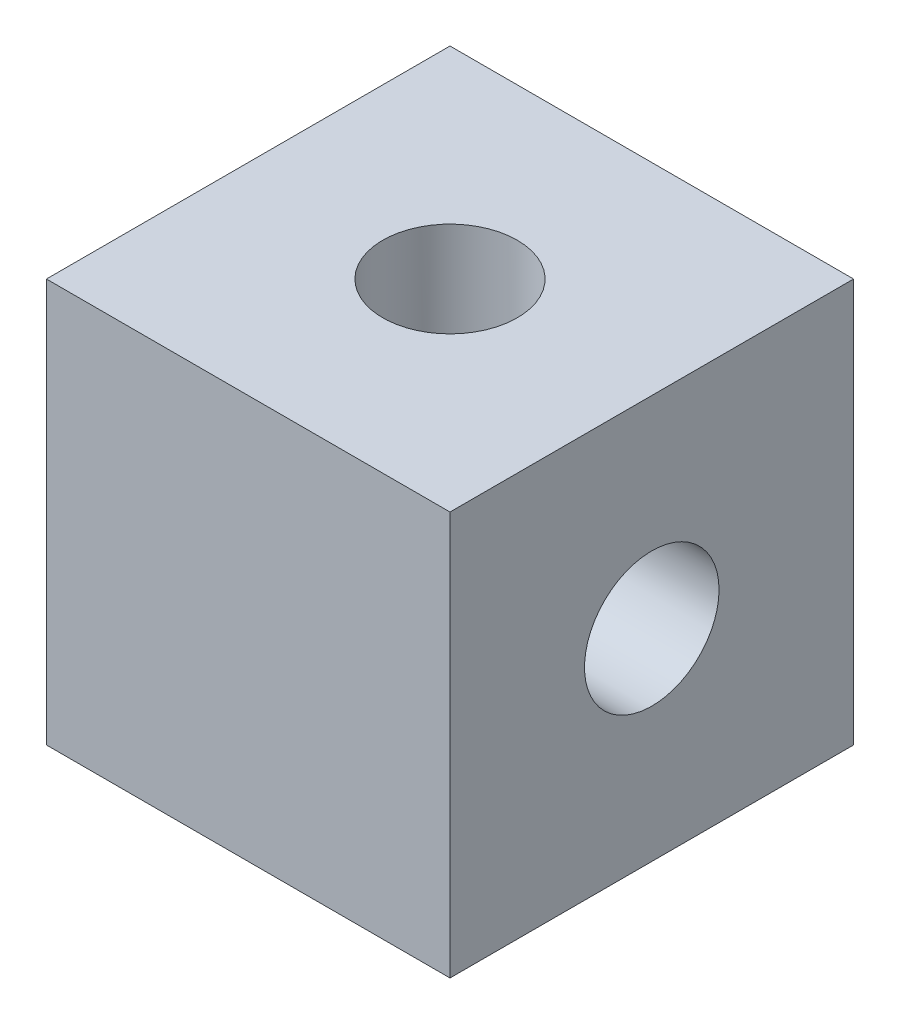
from build123d import *

# Parameters (mm, degrees)
SKETCH1_W           = 75
SKETCH1_H           = 75
BOSS_EXTRUDE1_DEPTH = 75
SKETCH2_R           = 12.5
CUT_EXTRUDE1_DEPTH  = 92.855865354
SKETCH5_R           = 12.5
CUT_EXTRUDE2_DEPTH  = 113.5


with BuildPart() as part:
    # Sketch1 → Boss-Extrude1 (new body)
    with BuildSketch(Plane(origin=(0, 0, 0), x_dir=(1, 0, 0), z_dir=(0, 1, 0))):
        Rectangle(SKETCH1_W, SKETCH1_H)
    extrude(amount=BOSS_EXTRUDE1_DEPTH)

    # Sketch2 → Cut-Extrude1 (cut, through all)
    with BuildSketch(Plane(origin=(0, 0, 0), x_dir=(-1, 0, 0), z_dir=(0, -1, 0))):
        with Locations(Location((0, 0, 0), (0, 0, 90))):
            Circle(SKETCH2_R)
    extrude(amount=-CUT_EXTRUDE1_DEPTH, mode=Mode.SUBTRACT)

    # Sketch5 → Cut-Extrude2 (cut, through all)
    with BuildSketch(Plane(origin=(37.5, 0, 0), x_dir=(0, 0, -1), z_dir=(1, 0, 0))):
        with Locations((0, 37.5)):
            Circle(SKETCH5_R)
    extrude(amount=-CUT_EXTRUDE2_DEPTH, mode=Mode.SUBTRACT)


solid = part.part
